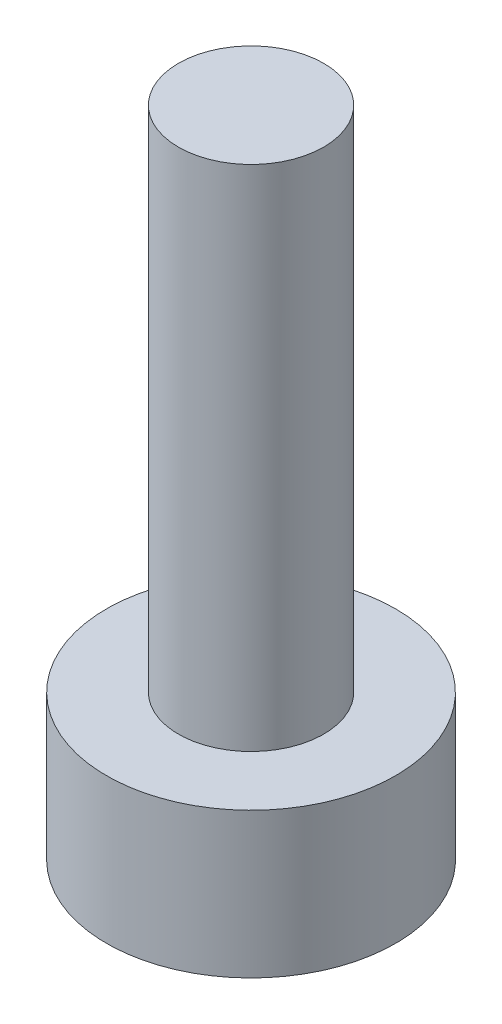
from build123d import *

# Parameters (mm, degrees)
SKETCH_1_R      = 1
EXTRUDE_1_DEPTH = 7
SKETCH_2_R      = 1.99
EXTRUDE_2_DEPTH = 2


with BuildPart() as part:
    # 草图1 → 凸台-拉伸1 (new body)
    with BuildSketch(Plane(origin=(0, 0, 0), x_dir=(1, 0, 0), z_dir=(0, 1, 0))):
        with Locations(Location((0, 0, 0), (0, 0, 270))):
            Circle(SKETCH_1_R)
    extrude(amount=EXTRUDE_1_DEPTH)

    # 草图2 → 凸台-拉伸2 (add)
    with BuildSketch(Plane.XZ):
        with Locations(Location((0, 0, 0), (0, 0, 270))):
            Circle(SKETCH_2_R)
    extrude(amount=EXTRUDE_2_DEPTH)


solid = part.part
